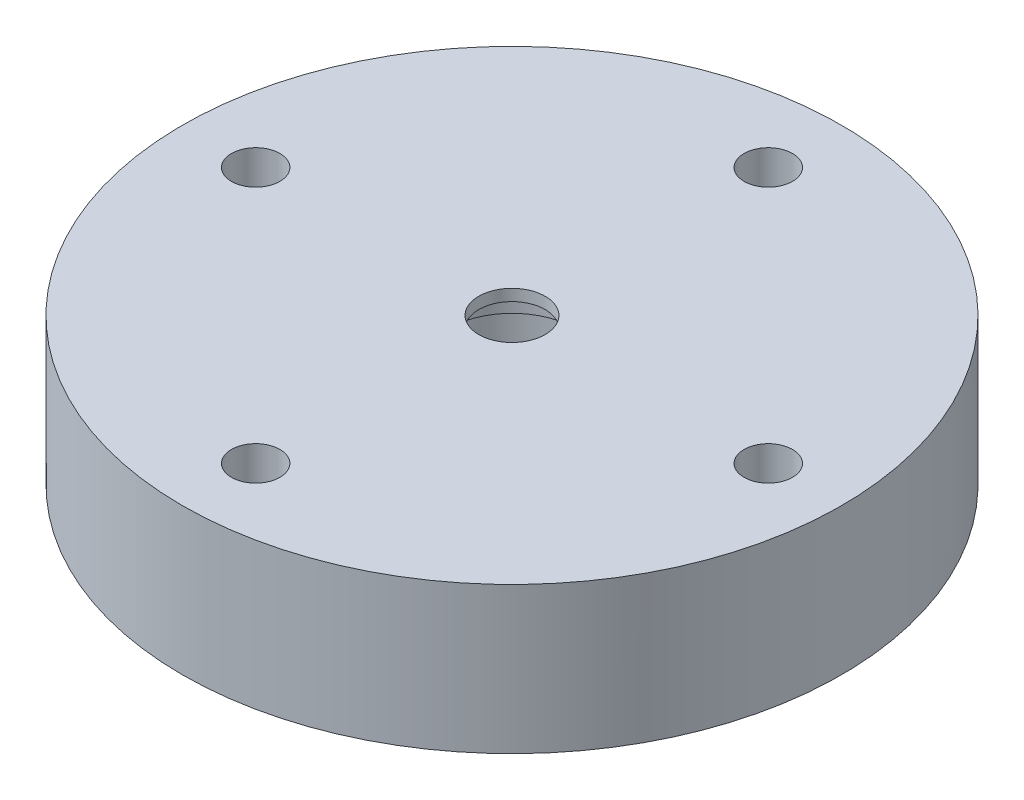
from build123d import *

# Parameters (mm, degrees)
SKETCH1_R                          = 57.15
SEAL_SEAT_HIEGHT_DEPTH             = 5.5372
SKETCH2_R                          = 57.15
SEAL_DIAPHRAM_HIEGHT_DEPTH         = 15.875
SEAL_START                         = 2
SKETCH3_R                          = 57.15
SEAL_SHOULDER_HIEGHT_DEPTH         = 2
SKETCH4_R                          = 57.15
BOTTOM_SEAL_CLEARANCE_DEPTH        = 2
SKETCH5_R                          = 11.1125
SEAL_SEAT_FIT_DEPTH                = 5.5372
SEAL_DIAPHRAM_CLEARANCE_DEPTH      = 2
SEAL_DIAPHRAM_CLEARANCE_DEPTH_BACK = 15.875
SKETCH6_R                          = 12.7
SKETCH7_R                          = 5.7625
SHAFT_CLEARANCE_DEPTH              = 2
M8_CLEARANCE_HOLE1_D               = 8.4


with BuildPart() as part:
    # Sketch1 → seal seat hieght (new body)
    with BuildSketch(Plane(origin=(0, 0, 0), x_dir=(1, 0, 0), z_dir=(0, 1, 0))):
        with Locations(Location((0, 0, 0), (0, 0, 270))):
            Circle(SKETCH1_R)
    extrude(amount=-SEAL_SEAT_HIEGHT_DEPTH)

    # Sketch2 → seal diaphram hieght (add)
    with BuildSketch(Plane.XZ.offset(5.5372)):
        with Locations(Location((0, 0, 0), (0, 0, 90))):
            Circle(SKETCH2_R)
    extrude(amount=SEAL_DIAPHRAM_HIEGHT_DEPTH)

    # Sketch3 → seal shoulder hieght (add)
    with BuildSketch(Plane(origin=(0, 0, 0), x_dir=(1, 0, 0), z_dir=(0, 1, 0)).offset(SEAL_START)):
        with Locations(Location((0, 0, 0), (0, 0, 270))):
            Circle(SKETCH3_R)
    extrude(amount=-SEAL_SHOULDER_HIEGHT_DEPTH)

    # Sketch4 → bottom seal clearance (add)
    with BuildSketch(Plane.XZ.offset(21.4122)):
        with Locations(Location((0, 0, 0), (0, 0, 90))):
            Circle(SKETCH4_R)
    extrude(amount=BOTTOM_SEAL_CLEARANCE_DEPTH)

    # Sketch5 → seal seat fit (cut)
    with BuildSketch(Plane(origin=(0, 0, 0), x_dir=(1, 0, 0), z_dir=(0, 1, 0))):
        with Locations(Location((0, 0, 0), (0, 0, 270))):
            Circle(SKETCH5_R)
    extrude(amount=-SEAL_SEAT_FIT_DEPTH, mode=Mode.SUBTRACT)

    # Sketch6 → seal diaphram clearance (cut, two sides: drawn at the far end of the back side and taken through both)
    with BuildSketch(Plane(origin=(0, -21.4122, 0), x_dir=(-1, 0, 0), z_dir=(0, -1, 0)).offset(-SEAL_DIAPHRAM_CLEARANCE_DEPTH_BACK)):
        with Locations(Location((0, 0, 0), (0, 0, 90))):
            Circle(SKETCH6_R)
    extrude(amount=SEAL_DIAPHRAM_CLEARANCE_DEPTH + SEAL_DIAPHRAM_CLEARANCE_DEPTH_BACK, mode=Mode.SUBTRACT)

    # Sketch7 → shaft clearance (cut)
    with BuildSketch(Plane(origin=(0, 0, 0), x_dir=(1, 0, 0), z_dir=(0, 1, 0))):
        with Locations(Location((0, 0, 0), (0, 0, 270))):
            Circle(SKETCH7_R)
    extrude(amount=SHAFT_CLEARANCE_DEPTH, mode=Mode.SUBTRACT)

    # M8 Clearance Hole1 (through all)
    with Locations(Plane(origin=(0, 2, 0), x_dir=(1, 0, 0), z_dir=(0, 1, 0))):
        with Locations((-44.45, 0), (0, 44.45), (44.45, 0), (0, -44.45)):
            Hole(M8_CLEARANCE_HOLE1_D / 2)


solid = part.part
